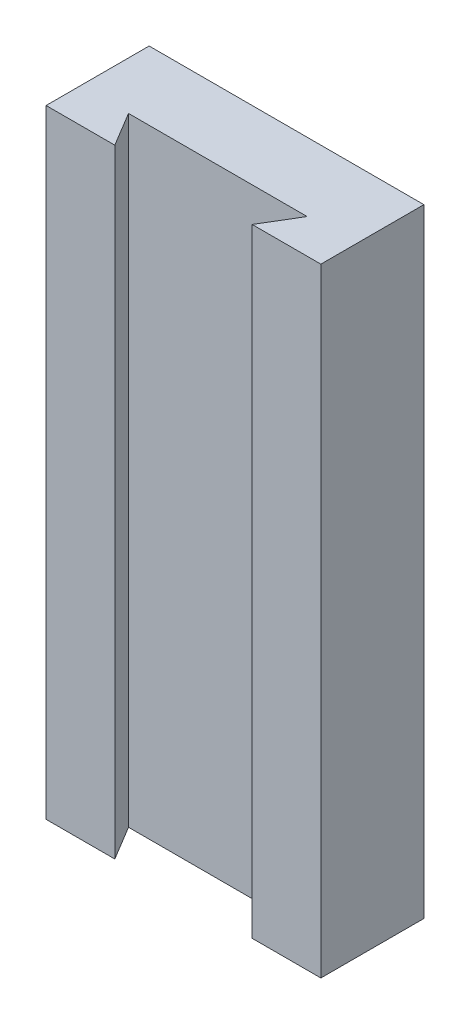
from build123d import *

# Parameters (mm, degrees)
SKETCH_1_W          = 40
SKETCH_1_H          = 90
EXTRUDE_1_DEPTH     = 15
CUT_EXTRUDE_1_DEPTH = 100.624294226


with BuildPart() as part:
    # 草图1 → 凸台-拉伸1 (new body)
    with BuildSketch(Plane.XY):
        with Locations((20, -45)):
            Rectangle(SKETCH_1_W, SKETCH_1_H)
    extrude(amount=EXTRUDE_1_DEPTH)

    # 草图2 → 切除-拉伸1 (cut, through all)
    with BuildSketch(Plane.XZ.offset(90)):
        Polygon((10, 15), (7, 10), (33, 10), (30, 15), align=None)
    extrude(amount=-CUT_EXTRUDE_1_DEPTH, mode=Mode.SUBTRACT)


solid = part.part
